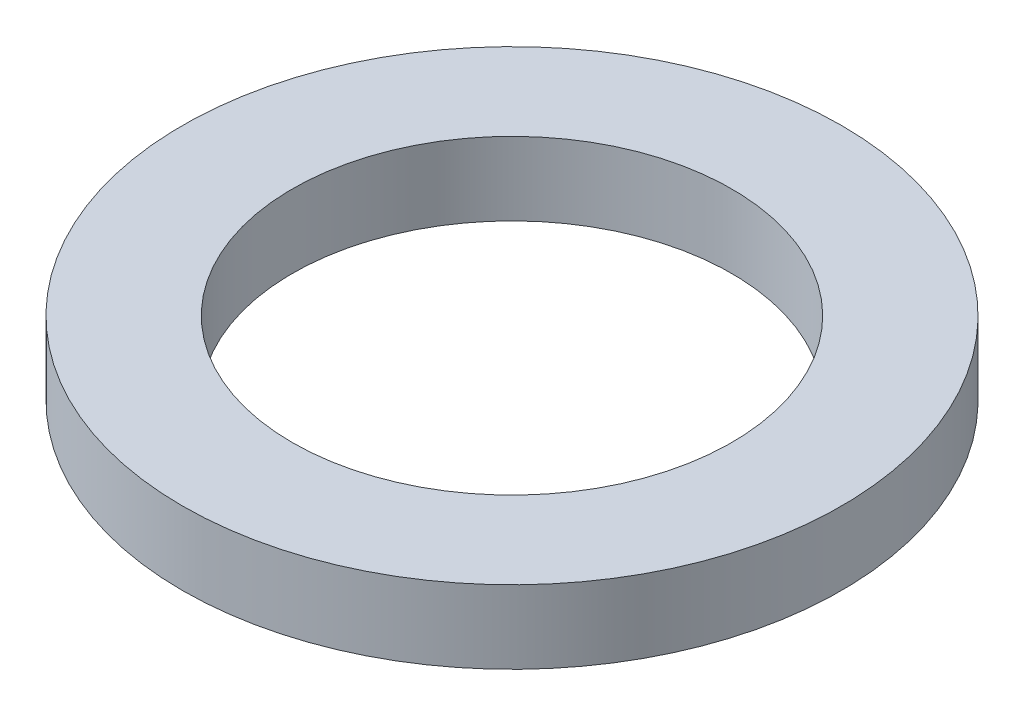
from build123d import *

# Parameters (mm, degrees)
SKETCH_1_R      = 2.25
SKETCH_1_R_2    = 1.5
EXTRUDE_1_DEPTH = 0.5


with BuildPart() as part:
    # 草图1 → 凸台-拉伸1 (new body)
    with BuildSketch(Plane(origin=(0, 0, 0), x_dir=(1, 0, 0), z_dir=(0, 1, 0))):
        with Locations(Location((0, 0, 0), (0, 0, 270))):
            Circle(SKETCH_1_R)
        with Locations(Location((0, 0, 0), (0, 0, 270))):
            Circle(SKETCH_1_R_2, mode=Mode.SUBTRACT)
    extrude(amount=EXTRUDE_1_DEPTH)


solid = part.part
